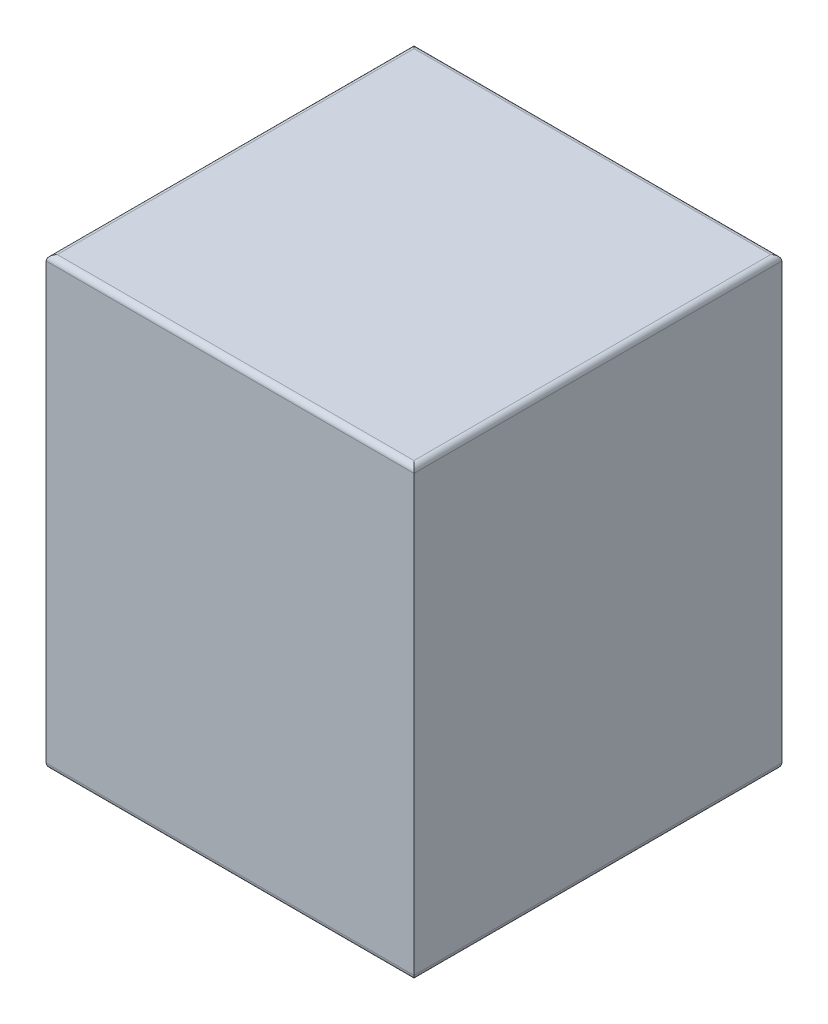
from build123d import *

# Parameters (mm, degrees)
SKETCH1_W           = 33
SKETCH1_H           = 33
BOSS_EXTRUDE1_DEPTH = 40
FILLET1_R           = 0.5


with BuildPart() as part:
    # Sketch1 → Boss-Extrude1 (new body)
    with BuildSketch(Plane(origin=(0, 0, 0), x_dir=(-1, 0, 0), z_dir=(0, 1, 0))):
        with Locations((-8.9e-08, -2.9e-07)):
            Rectangle(SKETCH1_W, SKETCH1_H)
    extrude(amount=BOSS_EXTRUDE1_DEPTH)

    # Fillet1
    fillet1_edges = [part.edges().sort_by_distance(p)[0] for p in [
        (16.500000089, 40, -2.9e-07),
        (8.9e-08, 40, -16.50000029),
        (-16.499999911, 40, -2.9e-07),
        (8.9e-08, 0, -16.50000029),
        (16.500000089, 0, -2.9e-07),
        (8.9e-08, 0, 16.49999971),
        (-16.499999911, 0, -2.9e-07),
        (8.9e-08, 40, 16.49999971),
    ]]
    fillet(fillet1_edges, radius=FILLET1_R)


solid = part.part
